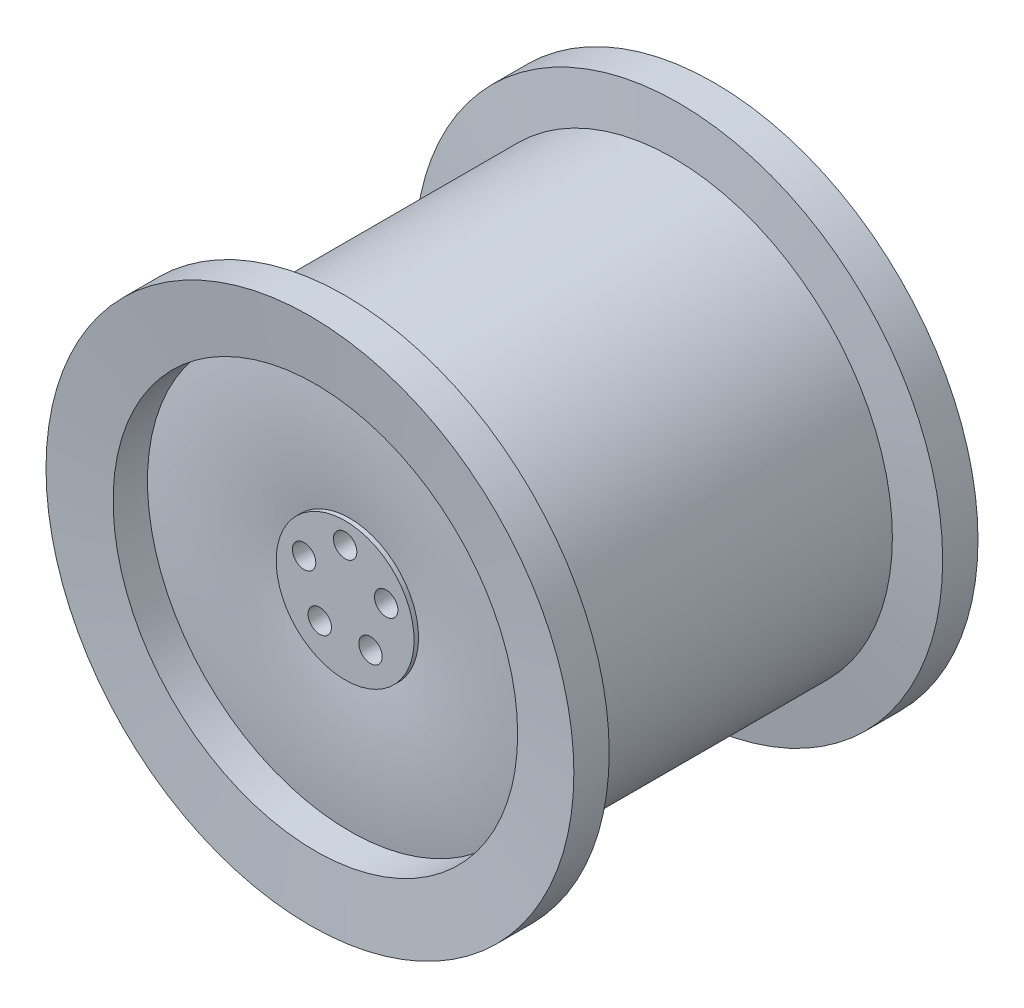
from build123d import *

# Parameters (mm, degrees)
SKETCH8_R           = 12.445803737
BOSS_EXTRUDE2_DEPTH = 7.961436264
SKETCH10_R          = 2.110408374
CUT_EXTRUDE1_DEPTH  = 137.414


with BuildPart() as part:
    # Sketch3 → Revolve2 (revolve)
    with BuildSketch(Plane(origin=(0, 0, 0), x_dir=(0, 0, -1), z_dir=(1, 0, 0)), mode=Mode.PRIVATE) as revolve2_sk:
        Polygon((29.100336298, 44.026196045), (-29.100336298, 44.026196045), (-30.085520968, 52.11445688), (-36.460084033, 52.11445688), (-35.478243613, 40.988977361), (35.478243613, 40.988977361), (36.460084033, 52.11445688), (30.085520968, 52.11445688), align=None)
    revolve(revolve2_sk.sketch.rotate(Axis((0, 4.491617138, 34.868994977), (0, 0, -1)), 90), axis=Axis((0, 4.491617138, 34.868994977), (0, 0, -1)))



with BuildPart() as body_2:
    # Sketch8 → Boss-Extrude2 (new body)
    with BuildSketch(Plane.XY.offset(22.147154131)):
        with Locations((0, 4.491617138)):
            Circle(SKETCH8_R)
    extrude(amount=BOSS_EXTRUDE2_DEPTH)

    # Sketch10 → Cut-Extrude1 (cut)
    with BuildSketch(Plane.XY.offset(40.64)):
        with Locations((0, 13.095758201)):
            Circle(SKETCH10_R)
        with Locations((7.407159638, 7.714141713)):
            Circle(SKETCH10_R)
        with Locations((4.577876416, -0.99349668)):
            Circle(SKETCH10_R)
        with Locations((-4.577876416, -0.99349668)):
            Circle(SKETCH10_R)
        with Locations((-7.407159638, 7.714141713)):
            Circle(SKETCH10_R)
    extrude(amount=-CUT_EXTRUDE1_DEPTH, mode=Mode.SUBTRACT)


with BuildPart() as part_1:
    add(part.part)

    add(body_2.part)  # Revolve4 merges body 2
    # Sketch12 → Revolve4 (revolve)
    with BuildSketch(Plane(origin=(0, 0, 0), x_dir=(0, 0, -1), z_dir=(1, 0, 0)), mode=Mode.PRIVATE) as revolve4_sk:
        with BuildLine():
            Line((-29.100336298, 42.19314735), (-26.54142097, 42.19314735))
            add(Edge.make_bspline(
                [(-26.54142097, 42.19314735), (-29.106417972, 28.876495724), (-26.54142097, 15.583923694)],
                knots=[0, 0, 0, 1, 1, 1], degree=2))
            Line((-26.54142097, 15.583923694), (-29.100336298, 15.583923694))
            add(Edge.make_bspline(
                [(-29.100336298, 42.19314735), (-31.192110403, 28.880503774), (-29.100336298, 15.583923694)],
                knots=[0, 0, 0, 1, 1, 1], degree=2))
        make_face()
    revolve(revolve4_sk.sketch.rotate(Axis((0, 4.491617138, 34.868994977), (0, 0, -1)), 90), axis=Axis((0, 4.491617138, 34.868994977), (0, 0, -1)))


solid = part_1.part
